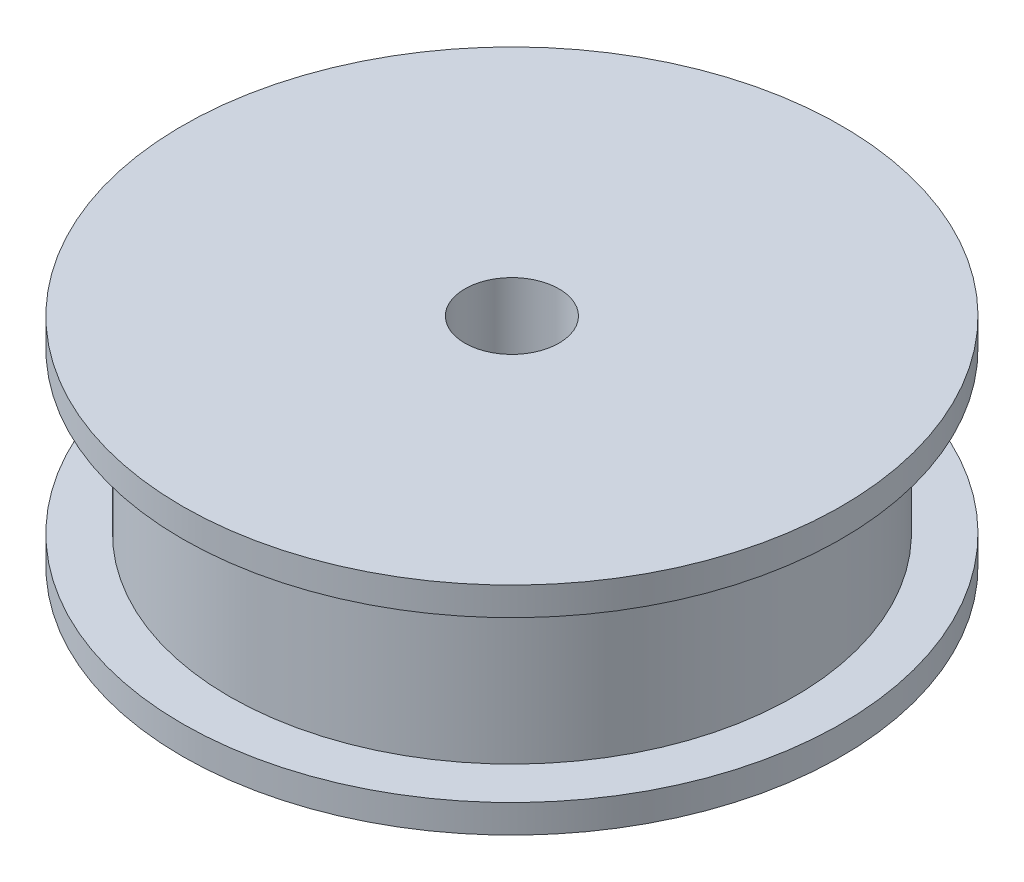
from build123d import *

# Parameters (mm, degrees)
SKETCH_205_R        = 15
EXTRUDE_1_DEPTH     = 5
EXTRUDE_START       = 5
SKETCH_286_R        = 17.5
EXTRUDE_1_2_DEPTH   = 1.5
EXTRUDE_START_2     = -5
SKETCH_2_2_R        = 17.5
EXTRUDE_2_DEPTH     = 1.5
SKETCH_407_R        = 2.5
CUT_EXTRUDE_1_DEPTH = 6.5


with BuildPart() as part:
    # Sketch 205 → Extrude 1 (new, symmetric)
    with BuildSketch(Plane(origin=(0, 0, 0), x_dir=(1, 0, 0), z_dir=(0, 1, 0))):
        with Locations(Location((0, 0, 0), (0, 0, 270))):
            Circle(SKETCH_205_R)
    extrude(amount=EXTRUDE_1_DEPTH, both=True)

    # Sketch 286 → Extrude 1 2 (add)
    with BuildSketch(Plane(origin=(0, 0, 0), x_dir=(1, 0, 0), z_dir=(0, 1, 0)).offset(EXTRUDE_START)):
        with Locations(Location((0, 0, 0), (0, 0, 270))):
            Circle(SKETCH_286_R)
    extrude(amount=EXTRUDE_1_2_DEPTH)

    # 草图2<2> → 边缘2 (add)
    with BuildSketch(Plane(origin=(0, 0, 0), x_dir=(1, 0, 0), z_dir=(0, 1, 0)).offset(EXTRUDE_START_2)):
        with Locations(Location((0, 0, 0), (0, 0, 270))):
            Circle(SKETCH_2_2_R)
    extrude(amount=EXTRUDE_2_DEPTH)

    # Sketch 407 → 切除-拉伸1 (cut, symmetric)
    with BuildSketch(Plane(origin=(0, 0, 0), x_dir=(1, 0, 0), z_dir=(0, 1, 0))):
        with Locations(Location((0, 0, 0), (0, 0, 270))):
            Circle(SKETCH_407_R)
    extrude(amount=CUT_EXTRUDE_1_DEPTH, both=True, mode=Mode.SUBTRACT)


solid = part.part
